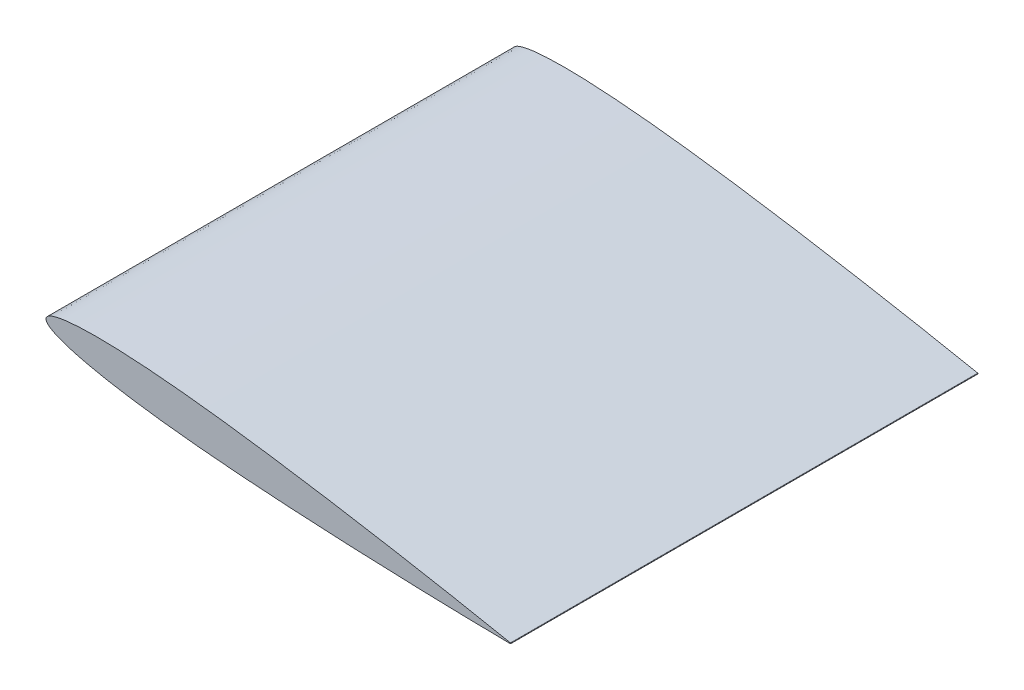
from build123d import *

# Parameters (mm, degrees)
BOSS_EXTRUDE1_DEPTH = 190.5


with BuildPart() as part:
    # Sketch1 → Boss-Extrude1 (new body)
    with BuildSketch(Plane.XY):
        with BuildLine():
            ThreePointArc((141.964209086, -14.760186421), (142.092315801, -14.934504189), (141.930624365, -15.078218817))
            add(Edge.make_bspline(
                [(141.964209086, -14.760186421), (141.717840284, -14.710745826), (141.33323944, -14.633364336), (140.779909053, -14.522319587), (140.27383726, -14.421069959), (139.676970786, -14.30177625), (138.989766271, -14.164762683), (138.213044346, -14.009909209), (137.347333734, -13.838208676), (136.39364252, -13.649542434), (135.352985792, -13.443778067), (134.226178355, -13.222425065), (133.014433444, -12.984703066), (131.718864681, -12.731586594), (130.340741086, -12.463347832), (128.881416543, -12.180757872), (127.342373318, -11.883621007), (125.724990221, -11.572940061), (124.030919727, -11.249308594), (122.261894134, -10.91255974), (120.419535289, -10.5637796), (118.505504201, -10.203518699), (116.521915523, -9.831646535), (114.470588395, -9.449580815), (112.353587299, -9.057460957), (110.172988249, -8.655672729), (107.930819738, -8.245213138), (105.629384861, -7.826312545), (103.270911798, -7.399604328), (100.857548376, -6.966148475), (98.391914567, -6.525834151), (95.876288308, -6.079710455), (93.313143727, -5.628483994), (90.705059175, -5.172285132), (88.054429581, -4.712612952), (85.363994222, -4.249387997), (82.636364474, -3.783252361), (79.874084434, -3.315633797), (77.080101431, -2.846363938), (74.256938094, -2.376594815), (71.407493553, -1.906839131), (67.563950812, -1.279853128), (63.694254127, -0.65802563), (59.801803491, -0.044070229), (56.862747805, 0.414441884), (53.914200665, 0.867926762), (50.959245533, 1.316247741), (48.000751242, 1.75875657), (45.04148157, 2.194083829), (42.084366125, 2.621971412), (39.132280403, 3.041824013), (36.188109134, 3.452186201), (33.254746628, 3.853028465), (30.335028764, 4.243013792), (27.431853272, 4.622182309), (24.547947931, 4.98881887), (21.686320197, 5.343362942), (18.849490105, 5.683928443), (16.040505056, 6.011365203), (13.261791716, 6.323461969), (9.626488244, 6.717239697), (6.039863102, 7.082462644), (2.505434875, 7.416473333), (-0.080933074, 7.648079272), (-2.621116917, 7.862056752), (-5.112569372, 8.058503362), (-7.552964337, 8.236214737), (-9.939704199, 8.396013944), (-12.270585767, 8.536580559), (-14.543278415, 8.65860387), (-16.755521787, 8.761521062), (-18.905149323, 8.84549821), (-21.639785426, 8.930229747), (-24.284491116, 8.979512863), (-26.836170841, 8.989645397), (-28.642141281, 8.977663809), (-30.373759902, 8.947610093), (-32.029317212, 8.898255154), (-33.607115113, 8.830847712), (-35.105581946, 8.745051508), (-36.523309443, 8.641242516), (-37.858829962, 8.519730205), (-39.110813755, 8.380500127), (-40.278016805, 8.224301565), (-41.35946116, 8.051414334), (-42.353955272, 7.861432587), (-43.260685397, 7.655335275), (-44.07884881, 7.433515895), (-44.807577498, 7.195317129), (-45.446709695, 6.942034274), (-45.995668636, 6.672863653), (-46.454485524, 6.388158236), (-46.823337262, 6.087193421), (-47.101118185, 5.768045021), (-47.286243052, 5.429498635), (-47.37373288, 5.073408677), (-47.362550731, 4.706898804), (-47.252222726, 4.33715213), (-47.047230685, 3.967022145), (-46.749378539, 3.595652351), (-46.360149479, 3.221391947), (-45.879521853, 2.843495365), (-45.30739142, 2.46230127), (-44.644490091, 2.077144185), (-43.890705509, 1.689324623), (-43.047023839, 1.298381071), (-42.114147907, 0.904866015), (-41.092669033, 0.509906782), (-39.983837251, 0.11335536), (-38.788550497, -0.284310339), (-37.507868841, -0.682097716), (-36.143095721, -1.079743151), (-34.695601765, -1.47663745), (-33.166685647, -1.872118781), (-31.557954595, -2.266187707), (-29.870808426, -2.657268364), (-28.107175652, -3.046205668), (-25.609662945, -3.569275801), (-23.012998651, -4.073489602), (-20.320983327, -4.561820995), (-18.201230371, -4.928697144), (-16.016286642, -5.29012983), (-13.768236222, -5.6455041), (-11.459407169, -5.994898227), (-9.091934724, -6.33715132), (-6.668249285, -6.67309449), (-4.190719253, -7.001380249), (-1.661870978, -7.322700537), (0.915824824, -7.636427856), (4.442058827, -8.048034209), (8.02585784, -8.440019334), (11.663225813, -8.814247154), (14.445836794, -9.089434988), (17.261255893, -9.355944156), (20.106648096, -9.61543027), (22.979210727, -9.866425724), (25.876085383, -10.110248627), (28.79442274, -10.345841026), (31.731196934, -10.574310476), (34.683582536, -10.795012474), (37.648526951, -11.008662199), (40.623193545, -11.214683969), (43.604457217, -11.413898565), (46.589381553, -11.606287547), (49.575047654, -11.791491408), (52.558466666, -11.970272083), (55.536697634, -12.142664299), (58.506696562, -12.308157652), (62.441529057, -12.520775665), (66.35575377, -12.720942515), (70.245478904, -12.910601767), (73.130191765, -13.046382128), (75.989205923, -13.176659889), (78.819579108, -13.301330894), (81.618603703, -13.42099485), (84.383432555, -13.534871484), (87.111279465, -13.643825663), (89.799456541, -13.747939867), (92.445301523, -13.846564231), (95.046159188, -13.940664533), (97.599480828, -14.029829712), (100.102699296, -14.114234007), (102.553367771, -14.194427575), (104.948947221, -14.269754784), (107.287115792, -14.340803616), (109.565562155, -14.407728069), (111.781985898, -14.470272366), (113.934195022, -14.528987826), (116.02007873, -14.58381808), (118.037588956, -14.634468256), (119.984650562, -14.681944819), (121.859222798, -14.725678449), (123.659566303, -14.765860589), (125.383868145, -14.803214619), (127.03046909, -14.837215524), (128.597629132, -14.868098611), (130.083790412, -14.896556589), (131.487544238, -14.92208846), (132.807405525, -14.945165516), (134.042076393, -14.965788873), (135.190264234, -14.984678953), (136.250945568, -15.000819191), (137.223008272, -15.015515593), (138.105487303, -15.028426637), (138.897421598, -15.039225729), (139.598086714, -15.048773378), (140.206705197, -15.056780778), (140.911128447, -15.065911105), (141.47545117, -15.072647184), (141.86773005, -15.077440355), (141.930624365, -15.078218817)],
                knots=[0, 0, 0, 0, 0.001960488, 0.003060783, 0.004403151, 0.0059871, 0.007809627, 0.009870238, 0.012166335, 0.014695452, 0.017455125, 0.020442713, 0.023654809, 0.027089354, 0.030741825, 0.034608687, 0.038686488, 0.042971159, 0.047458181, 0.052142622, 0.057020911, 0.062087544, 0.067338084, 0.072766456, 0.078367198, 0.084135835, 0.090065843, 0.096151268, 0.102386612, 0.108765354, 0.11528158, 0.121927783, 0.128698472, 0.135586708, 0.14258496, 0.14968731, 0.156886298, 0.164174398, 0.171545202, 0.178990235, 0.186503524, 0.1940766, 0.209373857, 0.217082105, 0.224820878, 0.232581679, 0.240357098, 0.248139213, 0.255920557, 0.263693736, 0.271450842, 0.279184434, 0.286886143, 0.294549552, 0.302166305, 0.309729004, 0.317230803, 0.324663343, 0.332020788, 0.339294805, 0.34647908, 0.360549207, 0.367421989, 0.374177392, 0.38080867, 0.387310567, 0.393675894, 0.399898905, 0.405973449, 0.411894305, 0.417655823, 0.423251855, 0.428678294, 0.439001415, 0.443888497, 0.448586274, 0.453091622, 0.457400294, 0.461508301, 0.46541243, 0.469110006, 0.472598492, 0.475874567, 0.478937452, 0.481785324, 0.484418023, 0.486835408, 0.489038388, 0.491029428, 0.49281391, 0.494397941, 0.495793426, 0.497018052, 0.498098706, 0.499074548, 0.5, 0.500925452, 0.501901294, 0.502981948, 0.504206574, 0.505602059, 0.50718609, 0.508970572, 0.510961612, 0.513164592, 0.515581977, 0.518214676, 0.521062548, 0.524125433, 0.527401508, 0.530889994, 0.53458757, 0.538491699, 0.542599706, 0.546908378, 0.551413726, 0.556111503, 0.560998585, 0.571321706, 0.576748145, 0.582344177, 0.588105695, 0.594026551, 0.600101095, 0.606324106, 0.612689433, 0.61919133, 0.625822608, 0.632578011, 0.639450793, 0.65352092, 0.660705195, 0.667979212, 0.675336657, 0.682769197, 0.690270996, 0.697833695, 0.705450448, 0.713113857, 0.720815566, 0.728549158, 0.736306264, 0.744079443, 0.751860787, 0.759642902, 0.767418321, 0.775179122, 0.782917895, 0.790626143, 0.8059234, 0.813496476, 0.821009765, 0.828454798, 0.835825602, 0.843113702, 0.85031269, 0.85741504, 0.864413292, 0.871301528, 0.878072217, 0.88471842, 0.891234646, 0.897613388, 0.903848732, 0.909934157, 0.915864165, 0.921632802, 0.927233544, 0.932661916, 0.937912456, 0.942979089, 0.947857378, 0.952541819, 0.957028841, 0.961313512, 0.965391313, 0.969258175, 0.972910646, 0.976345191, 0.979557287, 0.982544875, 0.985304548, 0.987833665, 0.990129762, 0.992190373, 0.9940129, 0.995596849, 0.996939217, 0.999509262, 1, 1, 1, 1], degree=3))
        make_face()
    extrude(amount=-BOSS_EXTRUDE1_DEPTH)


solid = part.part
